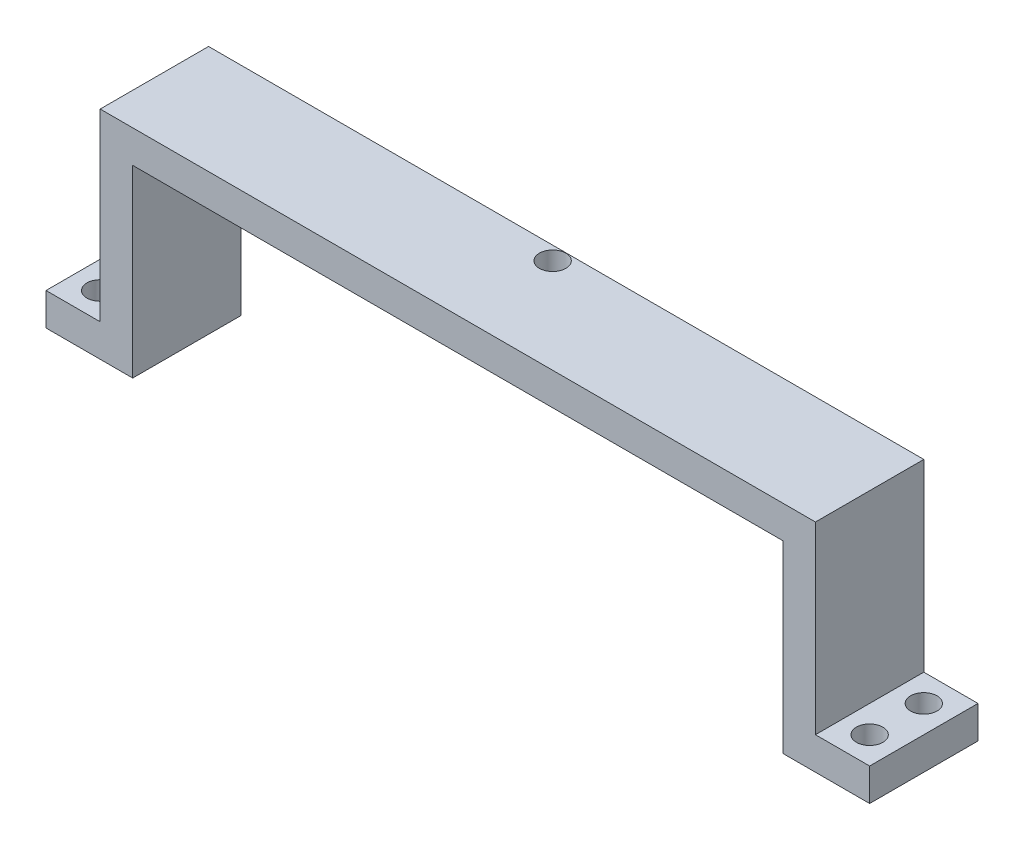
from build123d import *

# Parameters (mm, degrees)
SKETCH1_W           = 66
SKETCH1_H           = 5
BOSS_EXTRUDE1_DEPTH = 3
SKETCH3_W           = 3
SKETCH3_H           = 10
BOSS_EXTRUDE2_DEPTH = 14
SKETCH4_W           = 8
SKETCH4_H           = 10
BOSS_EXTRUDE3_DEPTH = 3
SKETCH5_R           = 1.22
CUT_EXTRUDE1_DEPTH  = 44.231932642
SKETCH6_R           = 1.22
CUT_EXTRUDE2_DEPTH  = 42.928510586


with BuildPart() as part:
    # Sketch1 → Boss-Extrude1 (new body)
    with BuildSketch(Plane(origin=(0, 0, 0), x_dir=(1, 0, 0), z_dir=(0, 1, 0))):
        with Locations((0, 2.5)):
            Rectangle(SKETCH1_W, SKETCH1_H)
        with Locations((0, -2.5)):
            Rectangle(SKETCH1_W, SKETCH1_H)
    extrude(amount=BOSS_EXTRUDE1_DEPTH)

    # Sketch3 → Boss-Extrude2 (add)
    with BuildSketch(Plane.XZ):
        with Locations((-31.5, 0)):
            Rectangle(SKETCH3_W, SKETCH3_H)
        with Locations((31.5, 0)):
            Rectangle(SKETCH3_W, SKETCH3_H)
    extrude(amount=BOSS_EXTRUDE2_DEPTH)

    # Sketch4 → Boss-Extrude3 (add)
    with BuildSketch(Plane.XZ.offset(14)):
        with Locations((-34, 0)):
            Rectangle(SKETCH4_W, SKETCH4_H)
        with Locations((34, 0)):
            Rectangle(SKETCH4_W, SKETCH4_H)
    extrude(amount=BOSS_EXTRUDE3_DEPTH)

    # Sketch5 → Cut-Extrude1 (cut, through all)
    with BuildSketch(Plane(origin=(0, 3, 0), x_dir=(1, 0, 0), z_dir=(0, 1, 0))):
        with Locations(Location((0, 3.75, 0), (0, 0, 270))):
            Circle(SKETCH5_R)
    extrude(amount=-CUT_EXTRUDE1_DEPTH, mode=Mode.SUBTRACT)

    # Sketch6 → Cut-Extrude2 (cut, through all)
    with BuildSketch(Plane(origin=(0, -14, 0), x_dir=(1, 0, 0), z_dir=(0, 1, 0))):
        with Locations(Location((-35.5, -2.5, 0), (0, 0, 270))):
            Circle(SKETCH6_R)
        with Locations(Location((-35.5, 2.5, 0), (0, 0, 270))):
            Circle(SKETCH6_R)
    cut_extrude2 = extrude(amount=-CUT_EXTRUDE2_DEPTH, mode=Mode.SUBTRACT)

    # Mirror1: Cut-Extrude2 across plane
    add(cut_extrude2.mirror(Plane(origin=(0, 0, 0), x_dir=(0, 0, 1), z_dir=(1, 0, 0))), mode=Mode.SUBTRACT)


solid = part.part
